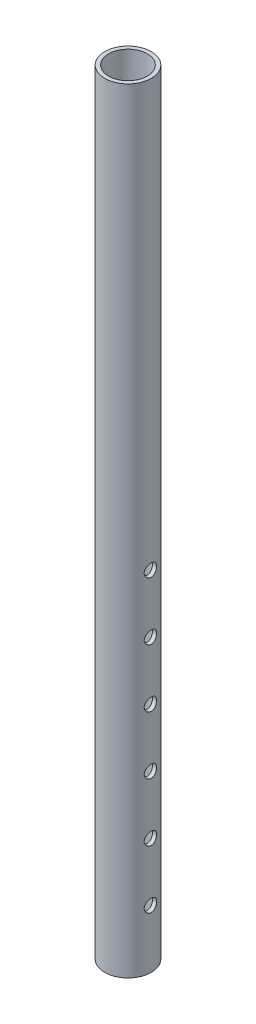
from build123d import *

# Parameters (mm, degrees)
SKETCH_1_R             = 6
SKETCH_1_R_2           = 5
EXTRUDE_1_DEPTH        = 200
SKETCH_4_R             = 1.6
CUT_EXTRUDE_2_DEPTH    = 201.179919073
PATTERN_LINEAR_1_COUNT = 6
PATTERN_LINEAR_1_PITCH = 15


with BuildPart() as part:
    # 草图1 → 凸台-拉伸1 (new body)
    with BuildSketch(Plane(origin=(0, 0, 0), x_dir=(1, 0, 0), z_dir=(0, 1, 0))):
        with Locations(Location((0, 0, 0), (0, 0, 270))):
            Circle(SKETCH_1_R)
        with Locations(Location((0, 0, 0), (0, 0, 270))):
            Circle(SKETCH_1_R_2, mode=Mode.SUBTRACT)
    extrude(amount=EXTRUDE_1_DEPTH)

    # 草图4 → 切除-拉伸2 (cut, symmetric)
    with BuildSketch(Plane(origin=(0, 0, 0), x_dir=(0, 0, -1), z_dir=(1, 0, 0))):
        with Locations((0, 15)):
            Circle(SKETCH_4_R)
    cut_extrude_2 = extrude(amount=CUT_EXTRUDE_2_DEPTH, both=True, mode=Mode.SUBTRACT)

    # 阵列(线性)1: 切除-拉伸2 ×6
    with Locations(*[(0, i * PATTERN_LINEAR_1_PITCH, 0) for i in range(1, PATTERN_LINEAR_1_COUNT)]):
        add(cut_extrude_2, mode=Mode.SUBTRACT)


solid = part.part
